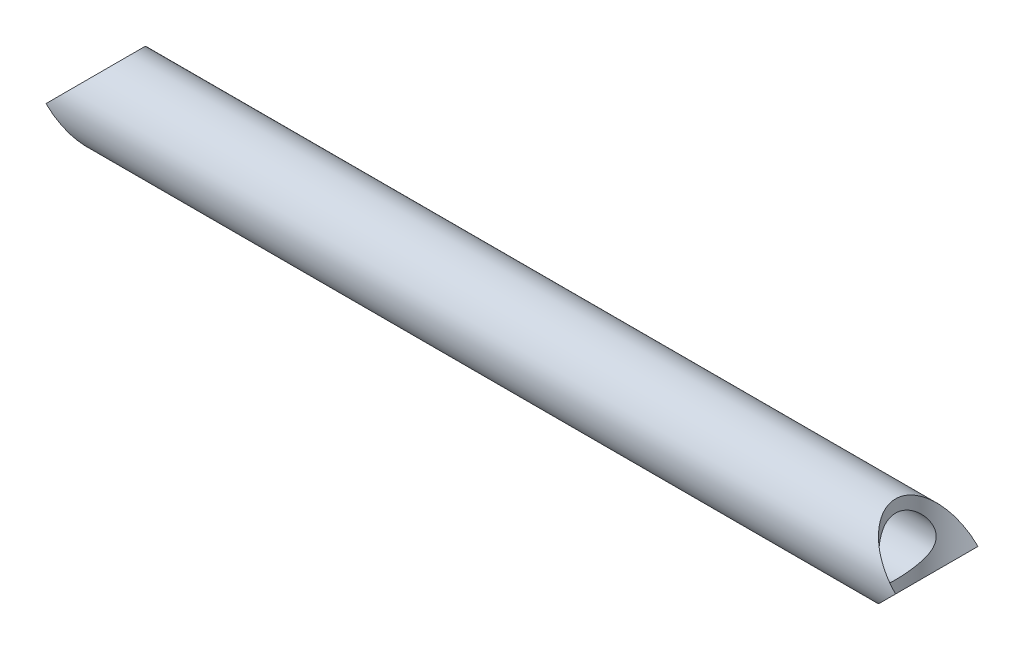
from build123d import *

# Parameters (mm, degrees)
SKETCH3_R               = 50
SKETCH3_R_2             = 35
CUT_EXTRUDE1_DEPTH      = 1033.424331368
CUT_EXTRUDE1_DEPTH_BACK = 1033.424331368
SKETCH4_R               = 50


with BuildPart() as part:
    # Sweep1: sweep along a path in Sketch2
    with BuildLine(Plane(origin=(0, 0, 0), x_dir=(1, 0, 0), z_dir=(0, 1, 0))) as sweep1_path:
        Line((0, 0), (1030, 0))
    # Sketch3 → Sweep1 (sweep)
    with BuildSketch(Plane(origin=(0, 0, 0), x_dir=(0, 0, -1), z_dir=(1, 0, 0))):
        Circle(SKETCH3_R)
        Circle(SKETCH3_R_2, mode=Mode.SUBTRACT)
    sweep(path=sweep1_path.line)

    # Sketch4 → Cut-Extrude1 (cut, two sides: drawn at the far end of the back side and taken through both)
    with BuildSketch(Plane(origin=(0, 0, 0), x_dir=(1, 0, 0), z_dir=(0, 1, 0)).offset(-CUT_EXTRUDE1_DEPTH_BACK)):
        Circle(SKETCH4_R)
        with Locations((1030, 0)):
            Circle(SKETCH4_R)
    extrude(amount=CUT_EXTRUDE1_DEPTH + CUT_EXTRUDE1_DEPTH_BACK, mode=Mode.SUBTRACT)


solid = part.part
